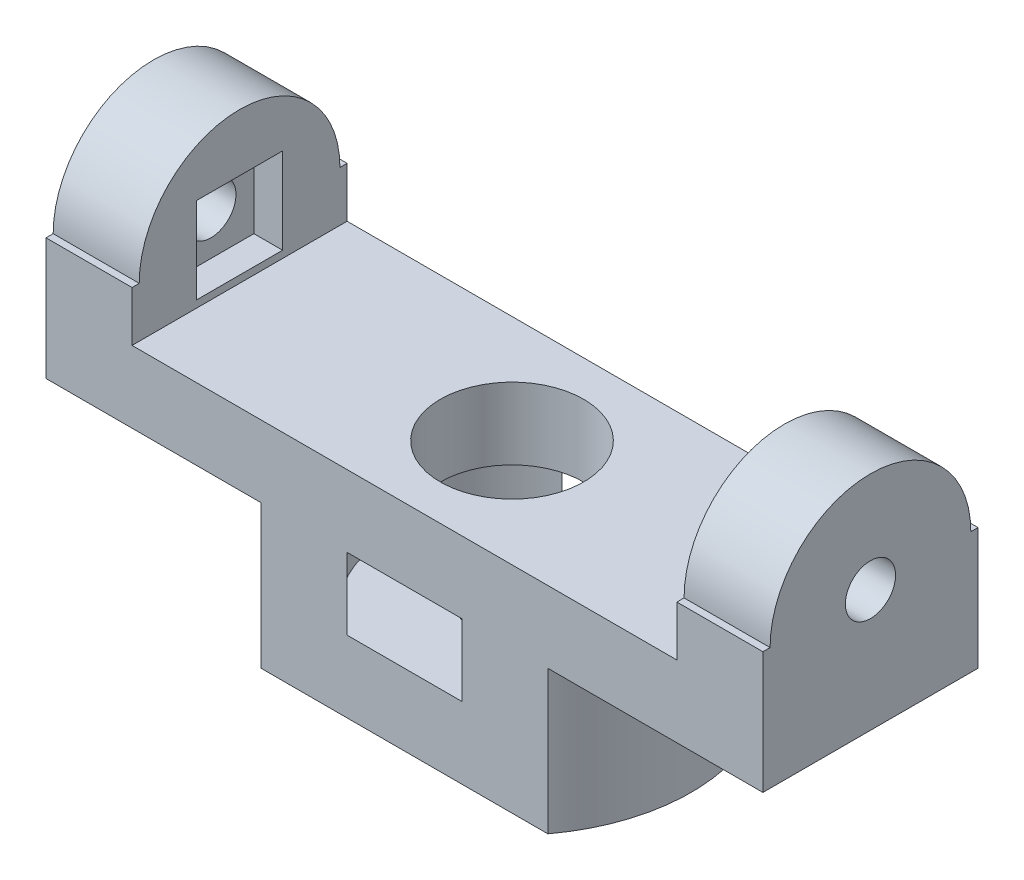
from build123d import *

# Parameters (mm, degrees)
EXTRUDE_1_DEPTH     = 15
SKETCH_3_R          = 1.75
CUT_EXTRUDE_2_DEPTH = 55.598534779
EXTRUDE_2_DEPTH     = 10
EXTRUDE_START       = -5
EXTRUDE_3_DEPTH     = 5
CUT_EXTRUDE_5_REACH = 60.097
SKETCH_6_R          = 2.75
SKETCH_7_R          = 5
CUT_EXTRUDE_6_DEPTH = 5
SKETCH_10_W         = 6
SKETCH_10_H         = 6
CUT_EXTRUDE_7_DEPTH = 2
SKETCH_11_W         = 6
SKETCH_11_H         = 6
CUT_EXTRUDE_8_DEPTH = 2


with BuildPart() as part:
    # 草图1 → 凸台-拉伸1 (new body)
    with BuildSketch(Plane.XY):
        Polygon((0, 0), (0, 16), (6, 16), (6, 5), (44, 5), (44, 16), (50, 16), (50, 0), align=None)
    extrude(amount=EXTRUDE_1_DEPTH)

    # 草图3 → 切除-拉伸2 (cut, through all)
    with BuildSketch(Plane(origin=(50, 0, 0), x_dir=(0, 0, -1), z_dir=(1, 0, 0))):
        with Locations(Location((-7.5, 8.5, 0), (0, 0, 90))):
            Circle(SKETCH_3_R)
        with BuildLine():
            Line((-14.5, 8.5), (-23.066471686, 8.5))
            Line((-23.066471686, 8.5), (-23.066471686, 64.301280236))
            Line((-23.066471686, 64.301280236), (5.906378089, 64.301280236))
            Line((5.906378089, 64.301280236), (5.906378089, 8.5))
            Line((5.906378089, 8.5), (-0.5, 8.5))
            ThreePointArc((-0.5, 8.5), (-7.5, 15.5), (-14.5, 8.5))
        make_face()
    extrude(amount=-CUT_EXTRUDE_2_DEPTH, mode=Mode.SUBTRACT)

    # 草图8 → 凸台-拉伸2 (add)
    with BuildSketch(Plane.XZ):
        with BuildLine():
            Line((15, 15), (21, 15))
            ThreePointArc((21, 15), (16.5, 7.5), (21, 0))
            Line((21, 0), (15, 0))
            ThreePointArc((15, 0), (12.5, 7.5), (15, 15))
        make_face()
        with BuildLine():
            Line((29, 15), (35, 15))
            ThreePointArc((35, 15), (37.5, 7.5), (35, 0))
            Line((35, 0), (29, 0))
            ThreePointArc((29, 0), (33.5, 7.5), (29, 15))
        make_face()
    extrude(amount=EXTRUDE_2_DEPTH)

    # 草图9 → 凸台-拉伸3 (add)
    with BuildSketch(Plane.XZ.offset(10).offset(EXTRUDE_START)):
        with BuildLine():
            Line((21, 15), (29, 15))
            Line((29, 15), (35, 15))
            ThreePointArc((35, 15), (37.5, 7.5), (35, 0))
            Line((35, 0), (29, 0))
            Line((29, 0), (21, 0))
            Line((21, 0), (15, 0))
            ThreePointArc((15, 0), (12.5, 7.5), (15, 15))
            Line((15, 15), (21, 15))
        make_face()
    extrude(amount=EXTRUDE_3_DEPTH)

    # 切除-拉伸5: up to this face of the body (flat: up to its plane)
    cut_extrude_5_end = Plane(part.part.faces().sort_by_distance((25, 5, 7.5))[0])
    # 草图6 → 切除-拉伸5 (cut, up to the picked face)
    with BuildSketch(Plane.XZ.offset(10), mode=Mode.PRIVATE) as cut_extrude_5_sk1:
        with Locations((25, 7.5)):
            Circle(SKETCH_6_R)
    cut_extrude_5_tool1 = split(extrude(cut_extrude_5_sk1.sketch, amount=-CUT_EXTRUDE_5_REACH, mode=Mode.PRIVATE), bisect_by=cut_extrude_5_end, keep=Keep.BOTH, mode=Mode.PRIVATE)
    add(cut_extrude_5_tool1.solids().sort_by(Axis((25, -10, 7.5), (0, 1, 0)))[0], mode=Mode.SUBTRACT)

    # 草图7 → 切除-拉伸6 (cut)
    with BuildSketch(Plane(origin=(0, 5, 0), x_dir=(1, 0, 0), z_dir=(0, 1, 0))):
        with Locations(Location((25, -7.5, 0), (0, 0, 180))):
            Circle(SKETCH_7_R)
    extrude(amount=-CUT_EXTRUDE_6_DEPTH, mode=Mode.SUBTRACT)

    # 草图10 → 切除-拉伸7 (cut)
    with BuildSketch(Plane.ZY.offset(-44)):
        with Locations((7.5, 8.5)):
            Rectangle(SKETCH_10_W, SKETCH_10_H)
    extrude(amount=-CUT_EXTRUDE_7_DEPTH, mode=Mode.SUBTRACT)

    # 草图11 → 切除-拉伸8 (cut)
    with BuildSketch(Plane(origin=(6, 0, 0), x_dir=(0, 0, -1), z_dir=(1, 0, 0))):
        with Locations((-7.5, 8.5)):
            Rectangle(SKETCH_11_W, SKETCH_11_H)
    extrude(amount=-CUT_EXTRUDE_8_DEPTH, mode=Mode.SUBTRACT)


solid = part.part
